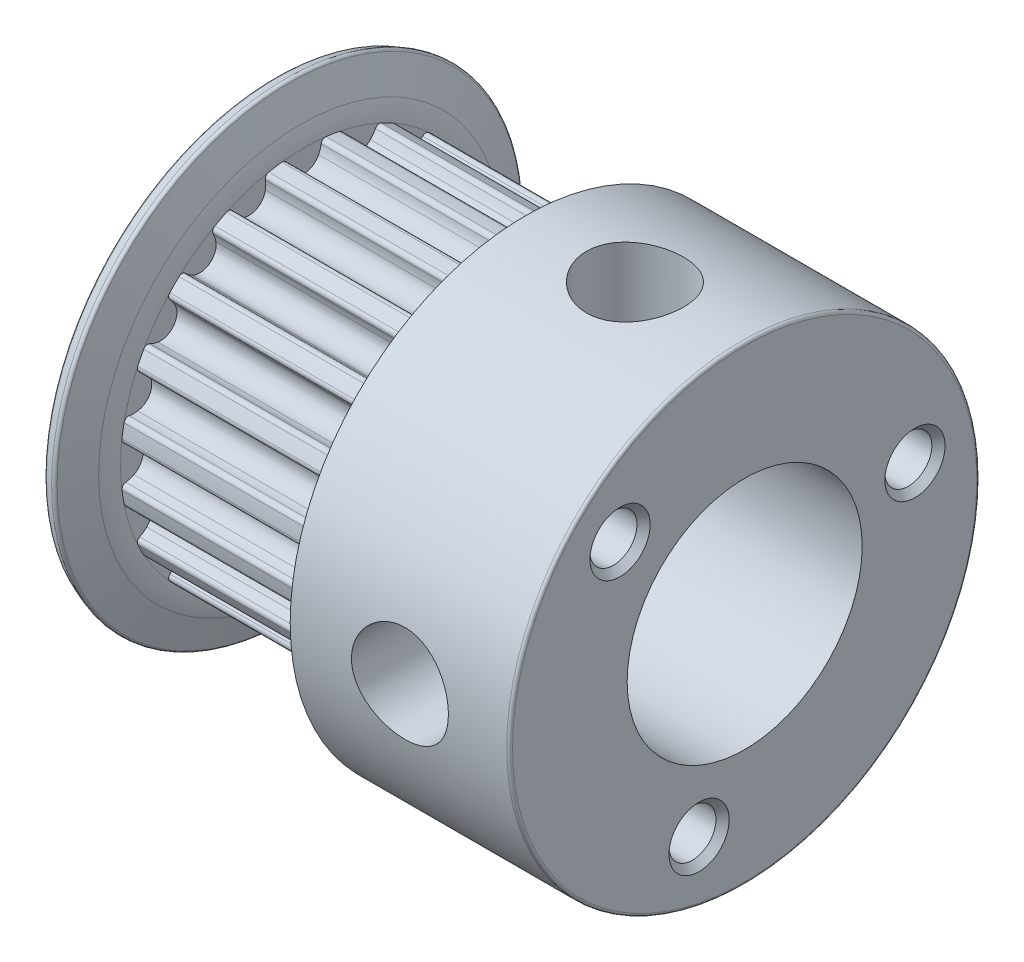
from build123d import *

# Parameters (mm, degrees)
SKETCH1_R                   = 6.239197724
SKETCH1_R_2                 = 4
BOSS_EXTRUDE1_DEPTH         = 3.5
CUT_EXTRUDE1_DEPTH          = 3.5
CIRPATTERN1_COUNT           = 20
FILLET1_R                   = 0.1
SKETCH6_W                   = 1.65
SKETCH6_H                   = 8
M2_TAPPED_HOLE1_D           = 1.6
M2_TAPPED_HOLE1_DEPTH       = 8
M2_TAPPED_HOLE1_CSINK_D     = 2.05
M2_TAPPED_HOLE1_CSINK_ANGLE = 90
M2_TAPPED_HOLE1_TIP         = 0.480688495


with BuildPart() as part:
    # Sketch1 → Boss-Extrude1 (new, symmetric)
    with BuildSketch(Plane(origin=(0, 0, 0), x_dir=(0, 0, -1), z_dir=(1, 0, 0))):
        Circle(SKETCH1_R)
        Circle(SKETCH1_R_2, mode=Mode.SUBTRACT)
    extrude(amount=BOSS_EXTRUDE1_DEPTH, both=True)

    # Sketch2 → Cut-Extrude1 (cut, symmetric)
    with BuildSketch(Plane(origin=(0, 0, 0), x_dir=(0, 0, -1), z_dir=(1, 0, 0))):
        with BuildLine():
            ThreePointArc((0.753665766, 6.19351081), (0, 6.239197724), (-0.753665766, 6.19351081))
            ThreePointArc((-0.753665766, 6.19351081), (-0.645307166, 6.164429342), (-0.587431713, 6.068316129))
            ThreePointArc((-0.587431713, 6.068316129), (-0.553499569, 5.924967979), (-0.498876404, 5.788160113))
            ThreePointArc((-0.498876404, 5.788160113), (0, 5.47636236), (0.498876404, 5.788160113))
            ThreePointArc((0.498876404, 5.788160113), (0.553499569, 5.924967979), (0.587431713, 6.068316129))
            ThreePointArc((0.587431713, 6.068316129), (0.645307166, 6.164429342), (0.753665766, 6.19351081))
        make_face()
    cut_extrude1 = extrude(amount=CUT_EXTRUDE1_DEPTH, both=True, mode=Mode.SUBTRACT)

    # CirPattern1: Cut-Extrude1 ×20 about axis
    cirpattern1_axis = Axis((0, 0, 0), (1, 0, 0))
    for i in range(1, CIRPATTERN1_COUNT):
        add(cut_extrude1.rotate(cirpattern1_axis, i * 360 / CIRPATTERN1_COUNT), mode=Mode.SUBTRACT)

    # Sketch3 → Revolve1 (revolve)
    with BuildSketch(Plane.XY, mode=Mode.PRIVATE) as revolve1_sk:
        with BuildLine():
            Line((-3.5, 4), (-3.5, 6.239197724))
            ThreePointArc((-3.5, 6.239197724), (-3.528735027, 6.562092031), (-3.614036981, 6.874837953))
            Line((-3.614036981, 6.874837953), (-4.03118248, 8))
            Line((-4.03118248, 8), (-4.5, 7.826189375))
            Line((-4.5, 7.826189375), (-4.082854501, 6.701027328))
            ThreePointArc((-4.082854501, 6.701027328), (-4.020877669, 6.473799222), (-4, 6.239197724))
            Line((-4, 6.239197724), (-4, 5))
            Line((-4, 5), (-4.25, 5))
            Line((-4.25, 5), (-4.25, 4.5))
            Line((-4.25, 4.5), (-4.5, 4.5))
            Line((-4.5, 4.5), (-4.5, 4))
            Line((-4.5, 4), (-3.5, 4))
        make_face()
        with BuildLine():
            Line((4.5, 4.5), (4.5, 4))
            Line((4.5, 4), (3.5, 4))
            Line((3.5, 4), (3.5, 6.239197724))
            ThreePointArc((3.5, 6.239197724), (3.528735027, 6.562092031), (3.614036981, 6.874837953))
            Line((3.614036981, 6.874837953), (4.03118248, 8))
            Line((4.03118248, 8), (4.5, 7.826189375))
            Line((4.5, 7.826189375), (4.082854501, 6.701027328))
            ThreePointArc((4.082854501, 6.701027328), (4.020877669, 6.473799222), (4, 6.239197724))
            Line((4, 6.239197724), (4, 5))
            Line((4, 5), (4.25, 5))
            Line((4.25, 5), (4.25, 4.5))
            Line((4.25, 4.5), (4.5, 4.5))
        make_face()
    revolve(revolve1_sk.sketch.rotate(Axis((0, 0, 0), (1, 0, 0)), 90), axis=Axis((0, 0, 0), (1, 0, 0)))

    # Sketch4 → Revolve2 (revolve)
    with BuildSketch(Plane.XY, mode=Mode.PRIVATE) as revolve2_sk:
        Polygon((4.03118248, 8), (11.5, 8), (11.5, 4), (3.821551363, 4), align=None)
    revolve(revolve2_sk.sketch.rotate(Axis((0, 0, 0), (1, 0, 0)), 90), axis=Axis((0, 0, 0), (1, 0, 0)))

    # Fillet1
    fillet1_edges = [part.edges().sort_by_distance(p)[0] for p in [
        (-4.03118248, 0, -8),
        (-4.5, 0, -7.826189375),
        (-4, 0, -5),
        (-4.25, 0, -5),
        (-4.25, 0, -4.5),
        (11.5, 0, -8),
    ]]
    fillet(fillet1_edges, radius=FILLET1_R)

    # Sketch6 → M4 Tapped Hole1 (revolve, cut)
    with BuildSketch(Plane.YZ.offset(7.76559124)):
        with Locations((0.825, 4)):
            Rectangle(SKETCH6_W, SKETCH6_H)
    revolve(axis=Axis((7.76559124, 0, -6.35), (0, 0, 1)), mode=Mode.SUBTRACT)

    # Sketch9 → M4 Tapped Hole2 (revolve, cut)
    with BuildSketch(Plane(origin=(7.76559124, 0, 0), x_dir=(0, 0, -1), z_dir=(1, 0, 0))):
        Polygon((0, 0), (0, 8), (1.65, 8), (1.65, 0.375), (2.025, 0), align=None)
    revolve(axis=Axis((7.76559124, -6.35, 0), (0, 1, 0)), mode=Mode.SUBTRACT)

    # M2 Tapped Hole1
    with Locations(Plane(origin=(11.5, 0, 0), x_dir=(0, 0, -1), z_dir=(1, 0, 0))):
        with Locations((-4.242640687, 4.242640687), (5.795554958, 1.552914271), (-1.552914271, -5.795554958)):
            CounterSinkHole(M2_TAPPED_HOLE1_D / 2, M2_TAPPED_HOLE1_CSINK_D / 2, depth=M2_TAPPED_HOLE1_DEPTH, counter_sink_angle=M2_TAPPED_HOLE1_CSINK_ANGLE)
            with Locations((0, 0, -(M2_TAPPED_HOLE1_DEPTH + M2_TAPPED_HOLE1_TIP / 2))):  # 118° drill point
                Cone(0, M2_TAPPED_HOLE1_D / 2, M2_TAPPED_HOLE1_TIP, mode=Mode.SUBTRACT)


solid = part.part
